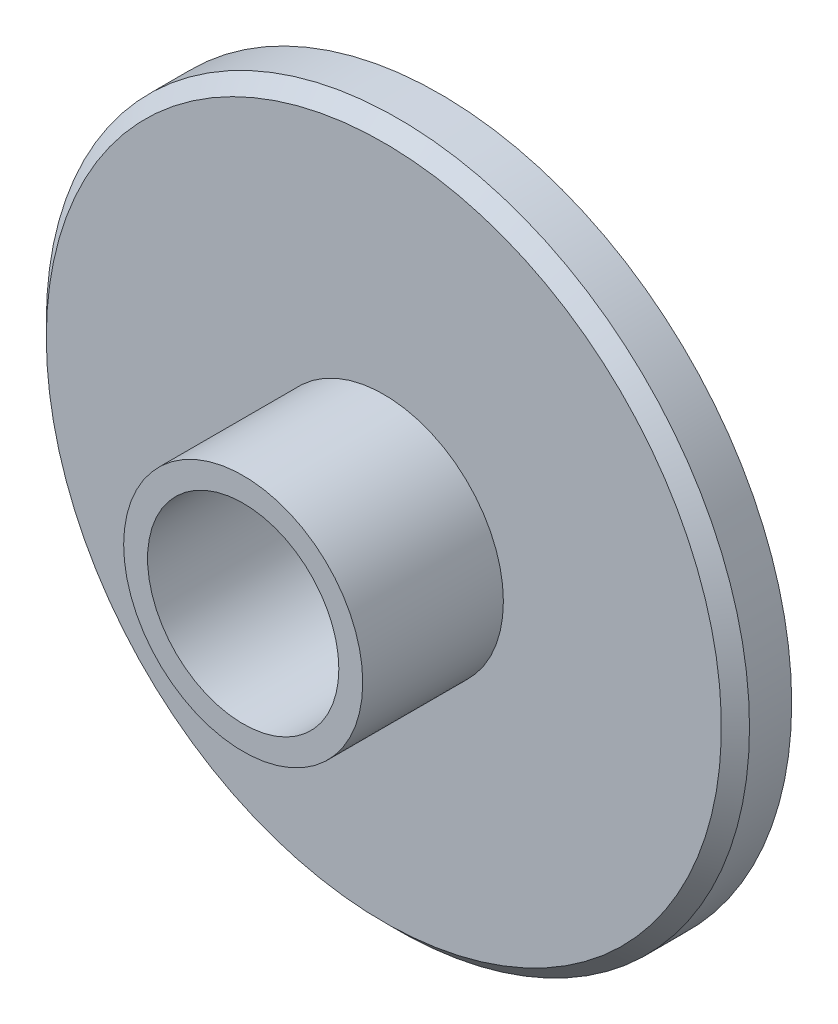
from build123d import *

# Parameters (mm, degrees)
CHAMFER1_SIZE = 0.5


with BuildPart() as part:
    # Sketch1 → Revolve1 (revolve)
    with BuildSketch(Plane(origin=(0, 0, 0), x_dir=(0, 0, -1), z_dir=(1, 0, 0)), mode=Mode.PRIVATE) as revolve1_sk:
        Polygon((0, 3.4), (0, 4.25), (5, 4.25), (5, 12.5), (7, 12.5), (7, 10.6), (6, 10.6), (6, 7.9), (7, 7.9), (7, 4.75), (8.2, 4.75), (8.2, 4), (8.5, 4), (8.5, 3.1), (5.2, 3.1), (5.2, 3.4), align=None)
    revolve(revolve1_sk.sketch.rotate(Axis((0, 0, 0), (0, 0, -1)), 90), axis=Axis((0, 0, 0), (0, 0, -1)))

    # Chamfer1
    chamfer1_edges = [part.edges().sort_by_distance(p)[0] for p in [
        (-12.5, 0, -5),
    ]]
    chamfer(chamfer1_edges, length=CHAMFER1_SIZE)


solid = part.part
